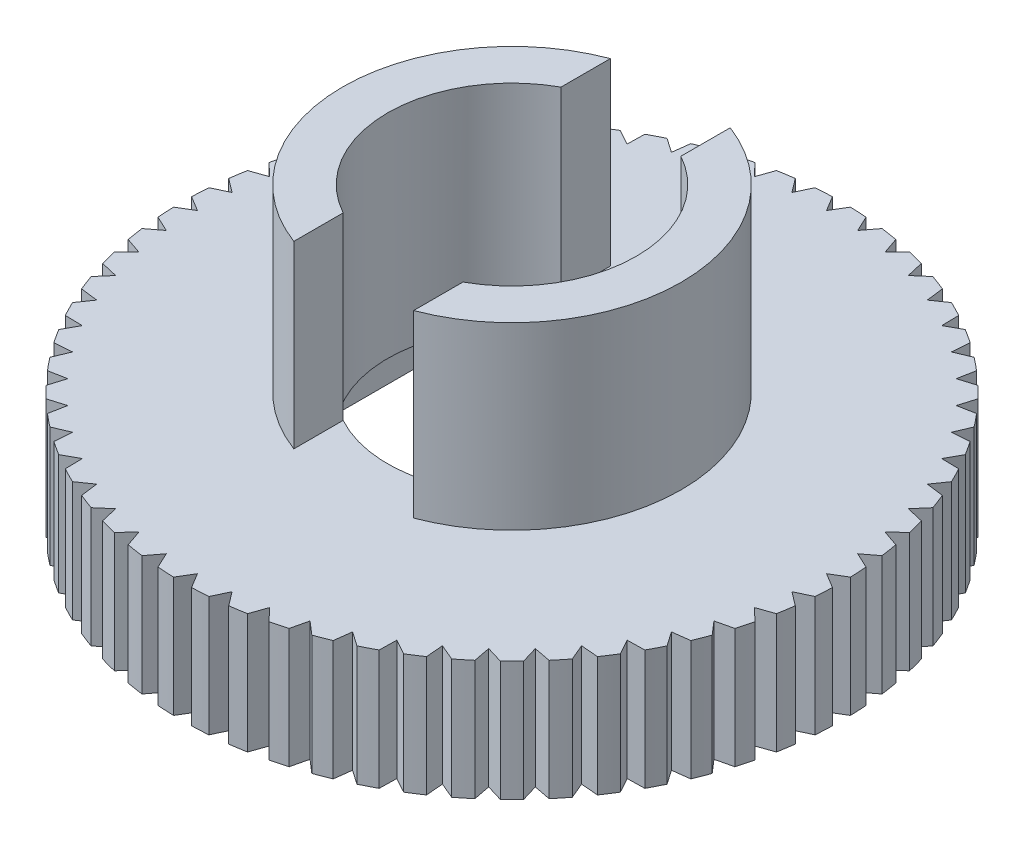
from build123d import *

# Parameters (mm, degrees)
SKETCH_1_R               = 5.65
SKETCH_1_R_2             = 4.15
EXTRUDE_1_DEPTH          = 10
SKETCH_1_3_R             = 11
SKETCH_1_3_R_2           = 5.65
EXTRUDE_2_DEPTH          = 4
CUT_EXTRUDE_1_DEPTH      = 2.9
CUT_EXTRUDE_START        = -4
CUT_EXTRUDE_2_DEPTH      = 4
PATTERN_CIRCULAR_1_COUNT = 60
CUT_EXTRUDE_START_2      = -6
CUT_EXTRUDE_3_DEPTH      = 6


with BuildPart() as part:
    # 草图1 → 凸台-拉伸1 (new body)
    with BuildSketch(Plane(origin=(0, 0, 0), x_dir=(1, 0, 0), z_dir=(0, 1, 0))):
        with Locations(Location((0, 0, 0), (0, 0, 270))):
            Circle(SKETCH_1_R)
        with Locations(Location((0, 0, 0), (0, 0, 270))):
            Circle(SKETCH_1_R_2, mode=Mode.SUBTRACT)
    extrude(amount=EXTRUDE_1_DEPTH)

    # 草图1<3> → 凸台-拉伸2 (add)
    with BuildSketch(Plane(origin=(0, 0, 0), x_dir=(1, 0, 0), z_dir=(0, 1, 0))):
        with Locations(Location((0, 0, 0), (0, 0, 270))):
            Circle(SKETCH_1_3_R)
        with Locations(Location((0, 0, 0), (0, 0, 270))):
            Circle(SKETCH_1_3_R_2, mode=Mode.SUBTRACT)
    extrude(amount=EXTRUDE_2_DEPTH)

    # 草图2 → 切除-拉伸1 (cut)
    with BuildSketch(Plane.XZ):
        Polygon((0, -7.274613392), (-6.3, -3.637306696), (-6.3, 3.637306696), (0, 7.274613392), (6.3, 3.637306696), (6.3, -3.637306696), align=None)
    extrude(amount=-CUT_EXTRUDE_1_DEPTH, mode=Mode.SUBTRACT)

    # 草图3 → 切除-拉伸2 (cut)
    with BuildSketch(Plane(origin=(0, 4, 0), x_dir=(1, 0, 0), z_dir=(0, 1, 0)).offset(CUT_EXTRUDE_START)):
        with BuildLine():
            Line((0, -10.5), (0.3, -10.99590833))
            ThreePointArc((0.3, -10.99590833), (0, -11), (-0.3, -10.99590833))
            Line((-0.3, -10.99590833), (0, -10.5))
        make_face()
    cut_extrude_2 = extrude(amount=CUT_EXTRUDE_2_DEPTH, mode=Mode.SUBTRACT)

    # 阵列(圆周)1: 切除-拉伸2 ×60 about axis
    pattern_circular_1_axis = Axis((0, 0, 0), (0, 1, 0))
    for i in range(1, PATTERN_CIRCULAR_1_COUNT):
        add(cut_extrude_2.rotate(pattern_circular_1_axis, i * 360 / PATTERN_CIRCULAR_1_COUNT), mode=Mode.SUBTRACT)

    # 草图4 → 切除-拉伸3 (cut)
    with BuildSketch(Plane(origin=(0, 10, 0), x_dir=(1, 0, 0), z_dir=(0, 1, 0)).offset(CUT_EXTRUDE_START_2)):
        with BuildLine():
            Line((-2, 5.284174486), (-2, 3.636275567))
            ThreePointArc((-2, 3.636275567), (0, 4.15), (2, 3.636275567))
            Line((2, 3.636275567), (2, 5.284174486))
            ThreePointArc((2, 5.284174486), (0, 5.65), (-2, 5.284174486))
        make_face()
        with BuildLine():
            Line((2, -3.636275567), (2, -5.284174486))
            ThreePointArc((2, -5.284174486), (0, -5.65), (-2, -5.284174486))
            Line((-2, -5.284174486), (-2, -3.636275567))
            ThreePointArc((-2, -3.636275567), (0, -4.15), (2, -3.636275567))
        make_face()
    extrude(amount=CUT_EXTRUDE_3_DEPTH, mode=Mode.SUBTRACT)


solid = part.part
